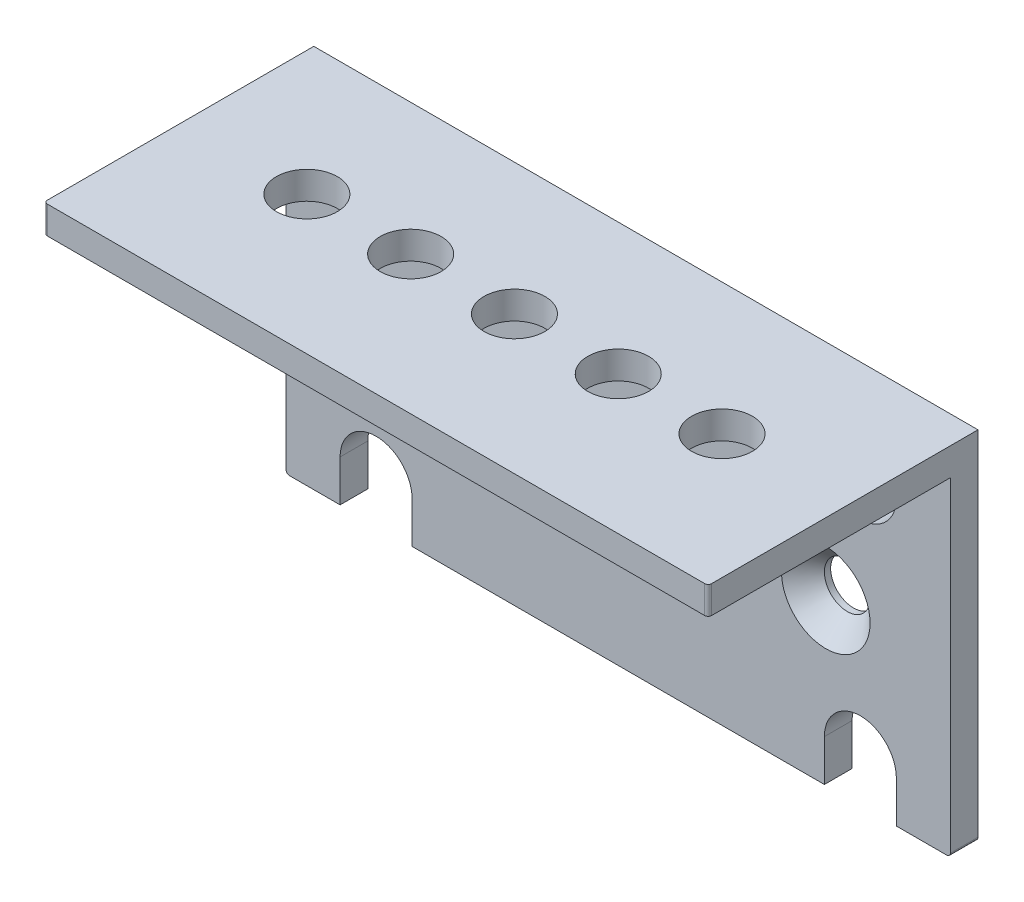
from build123d import *

# Parameters (mm, degrees)
SKETCH_1_W                  = 96
SKETCH_1_H                  = 47
EXTRUDE_1_DEPTH             = 4
SKETCH_12_W                 = 96
SKETCH_12_H                 = 39
SKETCH_12_R                 = 4.4
EXTRUDE_3_DEPTH             = 4.5
SKETCH_12_4_R               = 4.4
CUT_EXTRUDE_1_DEPTH         = 0.5
SKETCH_2_R                  = 5.2
CUT_EXTRUDE_2_DEPTH         = 10
HOLE_WIZARD_M6_1_AT_2_COUNT = 2
HOLE_WIZARD_M6_1_AT_2_PITCH = 30
HOLE_WIZARD_M6_1_AT_3_COUNT = 2
HOLE_WIZARD_M6_1_AT_3_PITCH = 60
FILLET_1_R                  = 0.5


with BuildPart() as part:
    # 草图1 → 凸台-拉伸1 (new body)
    with BuildSketch(Plane.XY):
        with Locations((48, -23.5)):
            Rectangle(SKETCH_1_W, SKETCH_1_H)
    extrude(amount=EXTRUDE_1_DEPTH)

    # 草图12 → 凸台-拉伸3 (add)
    with BuildSketch(Plane(origin=(0, 0, 0), x_dir=(1, 0, 0), z_dir=(0, 1, 0))):
        with Locations((48, -19.5)):
            Rectangle(SKETCH_12_W, SKETCH_12_H)
        with Locations((18, -19)):
            Circle(SKETCH_12_R, mode=Mode.SUBTRACT)
        with Locations((33, -19)):
            Circle(SKETCH_12_R, mode=Mode.SUBTRACT)
        with Locations((48, -19)):
            Circle(SKETCH_12_R, mode=Mode.SUBTRACT)
        with BuildLine():
            ThreePointArc((67.4, -19), (63, -23.4), (58.6, -19))
            ThreePointArc((58.6, -19), (63, -14.6), (67.4, -19))
        make_face(mode=Mode.SUBTRACT)
        with Locations((78, -19)):
            Circle(SKETCH_12_R, mode=Mode.SUBTRACT)
    extrude(amount=EXTRUDE_3_DEPTH)

    # 草图12<4> → 切除-拉伸1 (cut)
    with BuildSketch(Plane(origin=(0, 0, 0), x_dir=(1, 0, 0), z_dir=(0, 1, 0))):
        Polygon((96, -4), (0, -4), (0, -5), (0, -39), (96, -39), align=None)
        with Locations((18, -19)):
            Circle(SKETCH_12_4_R, mode=Mode.SUBTRACT)
        with Locations((33, -19)):
            Circle(SKETCH_12_4_R, mode=Mode.SUBTRACT)
        with Locations((48, -19)):
            Circle(SKETCH_12_4_R, mode=Mode.SUBTRACT)
        with BuildLine():
            ThreePointArc((67.4, -19), (63, -23.4), (58.6, -19))
            ThreePointArc((58.6, -19), (63, -14.6), (67.4, -19))
        make_face(mode=Mode.SUBTRACT)
        with BuildLine():
            ThreePointArc((82.4, -19), (78, -23.4), (73.6, -19))
            ThreePointArc((73.6, -19), (78, -14.6), (82.4, -19))
        make_face(mode=Mode.SUBTRACT)
    extrude(amount=CUT_EXTRUDE_1_DEPTH, mode=Mode.SUBTRACT)

    # 草图2 → 切除-拉伸2 (cut)
    with BuildSketch(Plane.XY.offset(4)):
        with BuildLine():
            Line((77.8, -41), (77.8, -47))
            Line((77.8, -47), (88.2, -47))
            Line((88.2, -47), (88.2, -41))
            ThreePointArc((88.2, -41), (83, -35.8), (77.8, -41))
        make_face()
        with BuildLine():
            Line((7.8, -47), (18.2, -47))
            Line((18.2, -47), (18.2, -41))
            ThreePointArc((18.2, -41), (13, -35.8), (7.8, -41))
            Line((7.8, -41), (7.8, -47))
        make_face()
        with Locations((83, -6)):
            Circle(SKETCH_2_R)
        with Locations((13, -6)):
            Circle(SKETCH_2_R)
    extrude(amount=-CUT_EXTRUDE_2_DEPTH, mode=Mode.SUBTRACT)

    # 草图15 → M6 内六角花形沉头螺钉的锥形沉头孔1 (revolve, cut)
    with BuildSketch(Plane(origin=(18, -23.5, 4), x_dir=(0, -1, 0), z_dir=(1, 0, 0))):
        Polygon((0, 0), (0, 4), (3.3, 4), (3.3, 3.1), (6.4, 0), align=None)
    hole_wizard_m6_1 = revolve(axis=Axis((18, -23.5, 10.35), (0, 0, -1)), mode=Mode.SUBTRACT)

    # M6 内六角花形沉头螺钉的锥形沉头孔1 at 2: M6 内六角花形沉头螺钉的锥形沉头孔1 ×2
    with Locations(*[(i * HOLE_WIZARD_M6_1_AT_2_PITCH, 0, 0) for i in range(1, HOLE_WIZARD_M6_1_AT_2_COUNT)]):
        add(hole_wizard_m6_1, mode=Mode.SUBTRACT)

    # M6 内六角花形沉头螺钉的锥形沉头孔1 at 3: M6 内六角花形沉头螺钉的锥形沉头孔1 ×2
    with Locations(*[(i * HOLE_WIZARD_M6_1_AT_3_PITCH, 0, 0) for i in range(1, HOLE_WIZARD_M6_1_AT_3_COUNT)]):
        add(hole_wizard_m6_1, mode=Mode.SUBTRACT)

    # 圆角1
    fillet_1_edges = [part.edges().sort_by_distance(p)[0] for p in [
        (0, -47, 2),
        (96, -47, 2),
        (96, 2.5, 39),
        (0, 2.5, 39),
    ]]
    fillet(fillet_1_edges, radius=FILLET_1_R)


solid = part.part
